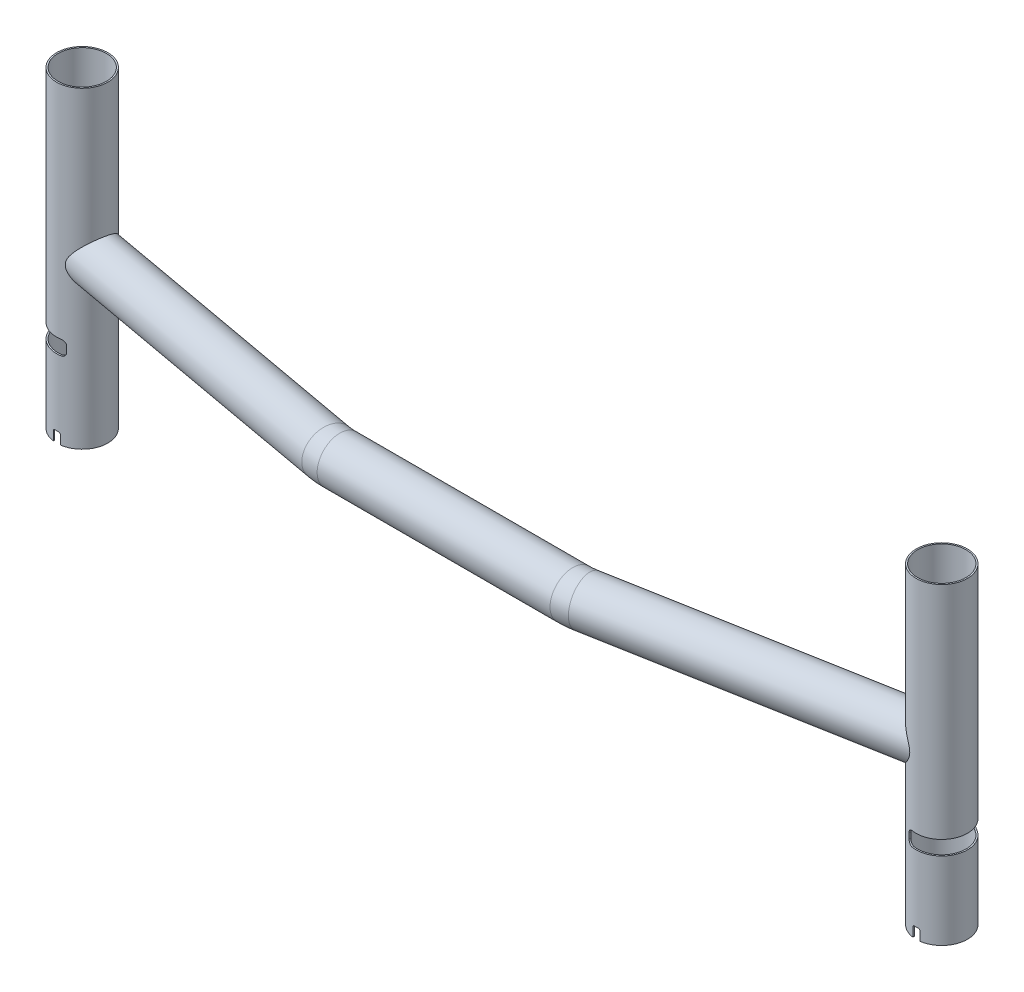
from build123d import *

# Parameters (mm, degrees)
SKETCH2_R               = 12.7
SKETCH2_R_2             = 11.899999999999999
BOSS_EXTRUDE1_START     = -88
SKETCH3_R               = 14.299999999999955
SKETCH3_R_2             = 13.500000000000002
BOSS_EXTRUDE1_DEPTH     = 174.5
SKETCH4_R               = 13.500000000000002
CUT_EXTRUDE1_DEPTH      = 312.6540844742015
SKETCH5_R               = 11.9
CUT_EXTRUDE2_DEPTH      = 88
CUT_EXTRUDE3_DEPTH      = 20
CUT_EXTRUDE5_REACH      = 274.804
CUT_EXTRUDE5_END_RADIUS = 13.5
CUT_EXTRUDE4_REACH      = 274.804
SKETCH8_R               = 2.9999999999999947


with BuildPart() as part:
    # Sweep1: sweep along a path in Sketch1
    with BuildLine(Plane(origin=(0, 0, 0), x_dir=(1, 0, 0), z_dir=(0, 1, 0))) as sweep1_path:
        Line((234, 30), (72.13858861003506, 0.6421475095924819))
        ThreePointArc((72.13858861003506, 0.6421475095924819), (68.58370620891968, 0.16086032796202687), (65, 0))
        Line((65, 0), (-65, 0))
        ThreePointArc((-65, 0), (-68.58370620891968, 0.16086032796202687), (-72.13858861003506, 0.6421475095924819))
        Line((-72.13858861003506, 0.6421475095924819), (-234, 30))
    # Sketch2 → Sweep1 (sweep)
    with BuildSketch(Plane(origin=(234.00000000000003, 0, -30.000000000000007), x_dir=(-0.1784647152508764, 0, -0.9839463122601881), z_dir=(0.9839463122601881, 0, -0.1784647152508764))):
        Circle(SKETCH2_R)
        Circle(SKETCH2_R_2, mode=Mode.SUBTRACT)
    sweep(path=sweep1_path.line)

    # Sketch3 → Boss-Extrude1 (add)
    with BuildSketch(Plane(origin=(0, 0, 0), x_dir=(1, 0, 0), z_dir=(0, 1, 0)).offset(BOSS_EXTRUDE1_START)):
        with Locations((239.9036778735612, 31.070788291505277)):
            Circle(SKETCH3_R)
        with Locations((239.9036778735612, 31.070788291505277)):
            Circle(SKETCH3_R_2, mode=Mode.SUBTRACT)
    boss_extrude1 = extrude(amount=BOSS_EXTRUDE1_DEPTH)

    # Sketch4 → Cut-Extrude1 (cut, through all)
    with BuildSketch(Plane.XZ.offset(88)):
        with Locations((239.9036778735612, -31.070788291505277)):
            Circle(SKETCH4_R)
    cut_extrude1 = extrude(amount=-CUT_EXTRUDE1_DEPTH, mode=Mode.SUBTRACT)

    # Sketch5 → Cut-Extrude2 (cut)
    with BuildSketch(Plane(origin=(234.00000000000003, 0, -30.000000000000007), x_dir=(-0.1784647152508764, 0, -0.9839463122601881), z_dir=(0.9839463122601881, 0, -0.1784647152508764))):
        with Locations((-0.01488844486755708, 0)):
            Circle(SKETCH5_R)
    cut_extrude2 = extrude(amount=-CUT_EXTRUDE2_DEPTH, mode=Mode.SUBTRACT)

    # Sketch7 → Cut-Extrude3 (cut, symmetric)
    with BuildSketch(Plane(origin=(239.9036778735612, 86.5, -31.07078829150528), x_dir=(-0.9413548600027745, 0, -0.337418179043686), z_dir=(0.337418179043686, 0, -0.9413548600027745))):
        with BuildLine():
            Line((-12.700000000000045, -123.23057124897107), (-27.49420398234936, -123.23057124897107))
            Line((-27.49420398234936, -123.23057124897107), (-27.49420398234936, -131.23057124897107))
            Line((-27.49420398234936, -131.23057124897107), (-12.700000000000045, -131.23057124897107))
            Line((-12.700000000000045, -131.23057124897107), (-2.500000000000017, -131.23057124897107))
            ThreePointArc((-2.500000000000017, -131.23057124897107), (-0.7322330470336271, -130.49833820193743), (1.8e-16, -128.73057124897105))
            Line((1.8e-16, -128.73057124897105), (-1.8e-16, -125.7305712489711))
            ThreePointArc((-1.8e-16, -125.7305712489711), (-0.7322330470336276, -123.9628042960047), (-2.5000000000000178, -123.23057124897107))
            Line((-2.5000000000000178, -123.23057124897107), (-12.700000000000045, -123.23057124897107))
        make_face()
    cut_extrude3 = extrude(amount=CUT_EXTRUDE3_DEPTH, both=True, mode=Mode.SUBTRACT)

    # Cut-Extrude5: up to this cylinder (the profile starts outside it)
    cut_extrude5_end = Plane(origin=(239.9036778735612, -88.052119, -31.070788291505277), z_dir=(0, 1, 0)) * Cylinder(CUT_EXTRUDE5_END_RADIUS, 577.608, mode=Mode.PRIVATE)
    # Sketch9 → Cut-Extrude5 (cut, up to the surface)
    with BuildSketch(Plane.XY, mode=Mode.PRIVATE) as cut_extrude5_sk1:
        with BuildLine():
            Line((238.9036778735612, -82), (240.9036778735612, -82))
            ThreePointArc((240.9036778735612, -82), (241.61078465474776, -82.29289321881345), (241.9036778735612, -83))
            Line((241.9036778735612, -83), (241.9036778735612, -94))
            Line((241.9036778735612, -94), (237.9036778735612, -94))
            Line((237.9036778735612, -94), (237.9036778735612, -83))
            ThreePointArc((237.9036778735612, -83), (238.19657109237465, -82.29289321881345), (238.9036778735612, -82))
        make_face()
    cut_extrude5_tool1 = extrude(cut_extrude5_sk1.sketch, amount=-CUT_EXTRUDE5_REACH, mode=Mode.PRIVATE) - cut_extrude5_end
    cut_extrude5 = cut_extrude5_tool1.solids().sort_by_distance((239.903678, -88.052119, 0))[0]
    add(cut_extrude5, mode=Mode.SUBTRACT)

    # Mirror1: Boss-Extrude1, Cut-Extrude1, Cut-Extrude2, Cut-Extrude3, Cut-Extrude5 across plane
    add(boss_extrude1.mirror(Plane(origin=(0, 0, 0), x_dir=(0, 0, 1), z_dir=(1, 0, 0))))
    add(cut_extrude1.mirror(Plane(origin=(0, 0, 0), x_dir=(0, 0, 1), z_dir=(1, 0, 0))), mode=Mode.SUBTRACT)
    add(cut_extrude2.mirror(Plane(origin=(0, 0, 0), x_dir=(0, 0, 1), z_dir=(1, 0, 0))), mode=Mode.SUBTRACT)
    add(cut_extrude3.mirror(Plane(origin=(0, 0, 0), x_dir=(0, 0, 1), z_dir=(1, 0, 0))), mode=Mode.SUBTRACT)
    add(cut_extrude5.mirror(Plane(origin=(0, 0, 0), x_dir=(0, 0, 1), z_dir=(1, 0, 0))), mode=Mode.SUBTRACT)

    # Sketch8 → Cut-Extrude4 (cut, up to next)
    with BuildSketch(Plane(origin=(0, 0, 0), x_dir=(1, 0, 0), z_dir=(0, 1, 0)), mode=Mode.PRIVATE) as cut_extrude4_sk1:
        with Locations((216.9875163818188, 26.593661315401395)):
            Circle(SKETCH8_R)
    cut_extrude4_tool1 = extrude(cut_extrude4_sk1.sketch, amount=-CUT_EXTRUDE4_REACH, mode=Mode.PRIVATE) & part.part
    add(cut_extrude4_tool1.solids().sort_by_distance((216.987516, 0, -26.593661))[0], mode=Mode.SUBTRACT)


solid = part.part
